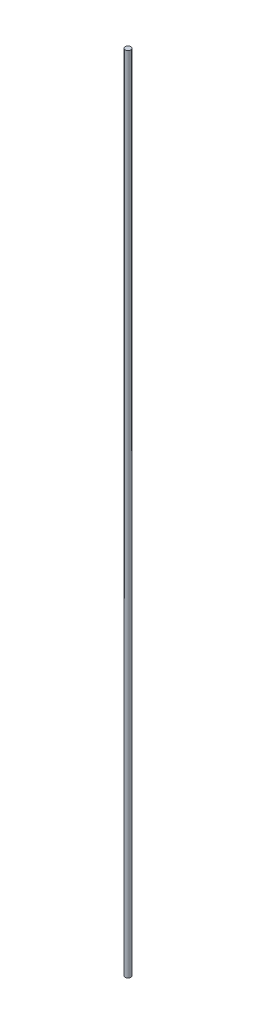
from build123d import *

# Parameters (mm, degrees)
SKETCH_1_R      = 1.75
EXTRUDE_1_DEPTH = 500


with BuildPart() as part:
    # 草图1 → 凸台-拉伸1 (new body)
    with BuildSketch(Plane(origin=(0, 0, 0), x_dir=(1, 0, 0), z_dir=(0, 1, 0))):
        with Locations(Location((0, 0, 0), (0, 0, 270))):
            Circle(SKETCH_1_R)
    extrude(amount=EXTRUDE_1_DEPTH)


solid = part.part
